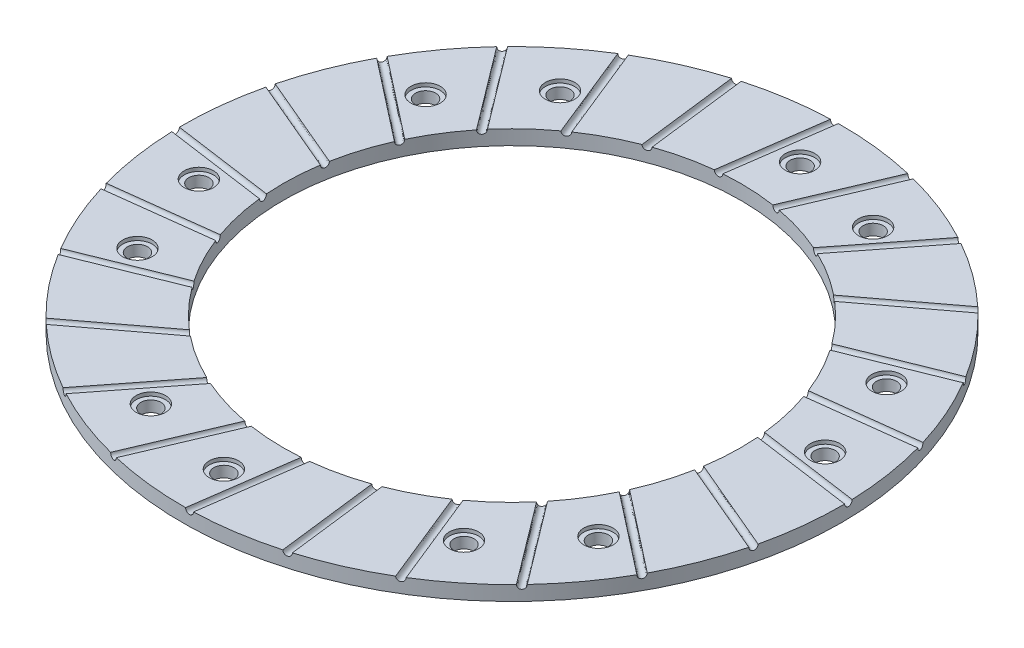
from build123d import *

# Parameters (mm, degrees)
SKETCH1_R                               = 90
SKETCH1_R_2                             = 62.5
EXTRUDE_THIN1_DEPTH                     = 4
SKETCH3_R                               = 1.125
CUT_EXTRUDE1_DEPTH                      = 139.425727693
CIRPATTERN1_COUNT                       = 24
CBORE_FOR_M5_HEX_HEAD_BOLT1_D           = 5.5
CBORE_FOR_M5_HEX_HEAD_BOLT1_CBORE_D     = 8
CBORE_FOR_M5_HEX_HEAD_BOLT1_CBORE_DEPTH = 1
CIRPATTERN2_COUNT                       = 6


with BuildPart() as part:
    # Sketch1 → Extrude-Thin1 (new body)
    with BuildSketch(Plane(origin=(0, 0, 0), x_dir=(1, 0, 0), z_dir=(0, 1, 0))):
        Circle(SKETCH1_R)
        Circle(SKETCH1_R_2, mode=Mode.SUBTRACT)
    extrude(amount=EXTRUDE_THIN1_DEPTH)

    # Sketch3 → Cut-Extrude1 (cut, through all, along a direction that is not the sketch's normal)
    with BuildSketch(Plane.XY):
        with Locations((-15.65, 4)):
            Circle(SKETCH3_R)
    cut_extrude1 = extrude(amount=-CUT_EXTRUDE1_DEPTH, dir=(-0.3907311284892778, 0, 0.9205048534524386), mode=Mode.SUBTRACT)

    # CirPattern1: Cut-Extrude1 ×24 about axis
    cirpattern1_axis = Axis((0, 4, 0), (0, -1, 0))
    for i in range(1, CIRPATTERN1_COUNT):
        add(cut_extrude1.rotate(cirpattern1_axis, i * 360 / CIRPATTERN1_COUNT), mode=Mode.SUBTRACT)

    # CBORE for M5 Hex Head Bolt1 (through all)
    with Locations(Plane(origin=(0, 4, 0), x_dir=(1, 0, 0), z_dir=(0, 1, 0))):
        with Locations((3, 75.690570747), (28.417446421, 70.217599211)):
            cbore_for_m5_hex_head_bolt1 = CounterBoreHole(CBORE_FOR_M5_HEX_HEAD_BOLT1_D / 2, CBORE_FOR_M5_HEX_HEAD_BOLT1_CBORE_D / 2, CBORE_FOR_M5_HEX_HEAD_BOLT1_CBORE_DEPTH)

    # CirPattern2: CBORE for M5 Hex Head Bolt1 ×6 about axis
    cirpattern2_axis = Axis((0, 0, 0), (0, 1, 0))
    for i in range(1, CIRPATTERN2_COUNT):
        add(cbore_for_m5_hex_head_bolt1.rotate(cirpattern2_axis, i * 360 / CIRPATTERN2_COUNT), mode=Mode.SUBTRACT)


solid = part.part
